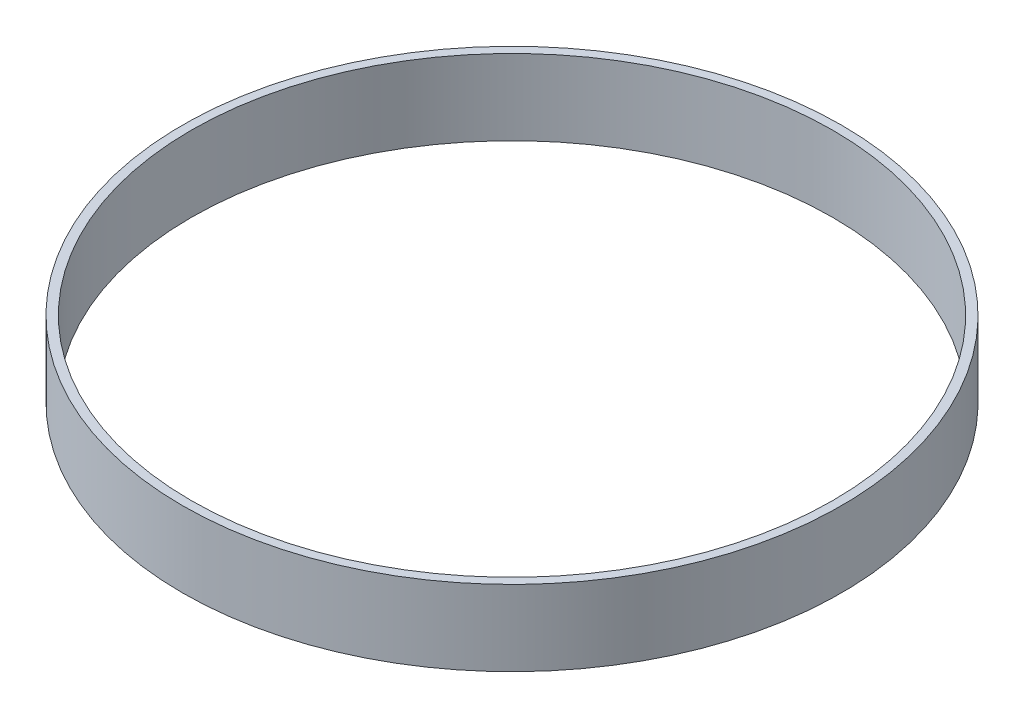
from build123d import *

# Parameters (mm, degrees)
SCHIZZO1_W = 2
SCHIZZO1_H = 17.2


with BuildPart() as part:
    # Schizzo1 → Rivoluzione1 (revolve)
    with BuildSketch(Plane.XY, mode=Mode.PRIVATE) as rivoluzione1_sk:
        with Locations((-74, 8.6)):
            Rectangle(SCHIZZO1_W, SCHIZZO1_H)
    revolve(rivoluzione1_sk.sketch.rotate(Axis((0, 0, 0), (0, 1, 0)), 270), axis=Axis((0, 0, 0), (0, 1, 0)))


solid = part.part
